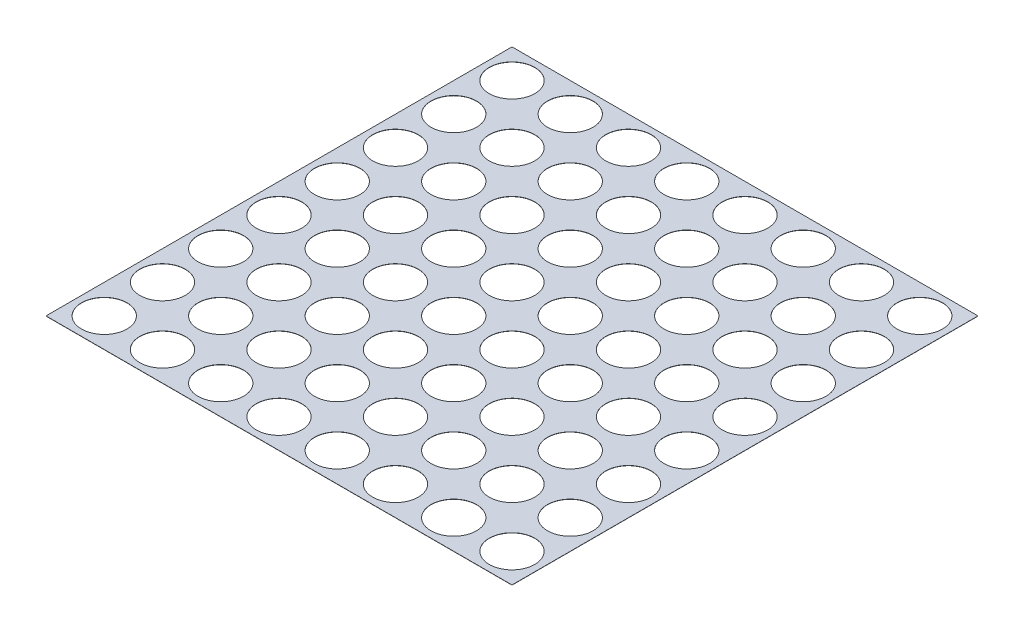
from build123d import *

# Parameters (mm, degrees)
ESBO_O1_W                = 256
ESBO_O1_H                = 256
RESSALTO_EXTRUS_O1_DEPTH = 0.1
ESBO_O2_R                = 12.5
CORTE_EXTRUS_O1_DEPTH    = 182.019363605


with BuildPart() as part:
    # Esboço1 → Ressalto-extrusão1 (new body)
    with BuildSketch(Plane(origin=(0, 0, 0), x_dir=(1, 0, 0), z_dir=(0, 1, 0))):
        Rectangle(ESBO_O1_W, ESBO_O1_H)
    extrude(amount=RESSALTO_EXTRUS_O1_DEPTH)

    # Esboço2 → Corte-extrusão1 (cut, through all)
    with BuildSketch(Plane(origin=(0, 0.1, 0), x_dir=(1, 0, 0), z_dir=(0, 1, 0))):
        with Locations(Location((-112, -112, 0), (0, 0, 270))):
            Circle(ESBO_O2_R)
        with Locations(Location((-80, -112, 0), (0, 0, 90))):
            Circle(ESBO_O2_R)
        with Locations(Location((-48, -112, 0), (0, 0, 270))):
            Circle(ESBO_O2_R)
        with Locations(Location((-16, -112, 0), (0, 0, 90))):
            Circle(ESBO_O2_R)
        with Locations(Location((16, -112, 0), (0, 0, 270))):
            Circle(ESBO_O2_R)
        with Locations(Location((48, -112, 0), (0, 0, 90))):
            Circle(ESBO_O2_R)
        with Locations(Location((80, -112, 0), (0, 0, 270))):
            Circle(ESBO_O2_R)
        with Locations(Location((112, -112, 0), (0, 0, 90))):
            Circle(ESBO_O2_R)
        with Locations(Location((112, -80, 0), (0, 0, 270))):
            Circle(ESBO_O2_R)
        with Locations(Location((80, -80, 0), (0, 0, 90))):
            Circle(ESBO_O2_R)
        with Locations(Location((48, -80, 0), (0, 0, 270))):
            Circle(ESBO_O2_R)
        with Locations(Location((16, -80, 0), (0, 0, 90))):
            Circle(ESBO_O2_R)
        with Locations(Location((-16, -80, 0), (0, 0, 270))):
            Circle(ESBO_O2_R)
        with Locations(Location((-48, -80, 0), (0, 0, 90))):
            Circle(ESBO_O2_R)
        with Locations(Location((-80, -80, 0), (0, 0, 270))):
            Circle(ESBO_O2_R)
        with Locations(Location((-112, -80, 0), (0, 0, 90))):
            Circle(ESBO_O2_R)
        with Locations(Location((112, -16, 0), (0, 0, 270))):
            Circle(ESBO_O2_R)
        with Locations(Location((112, -48, 0), (0, 0, 90))):
            Circle(ESBO_O2_R)
        with Locations(Location((80, -16, 0), (0, 0, 90))):
            Circle(ESBO_O2_R)
        with Locations(Location((80, -48, 0), (0, 0, 270))):
            Circle(ESBO_O2_R)
        with Locations(Location((48, -16, 0), (0, 0, 270))):
            Circle(ESBO_O2_R)
        with Locations(Location((48, -48, 0), (0, 0, 90))):
            Circle(ESBO_O2_R)
        with Locations(Location((16, -16, 0), (0, 0, 90))):
            Circle(ESBO_O2_R)
        with Locations(Location((16, -48, 0), (0, 0, 270))):
            Circle(ESBO_O2_R)
        with Locations(Location((-16, -16, 0), (0, 0, 270))):
            Circle(ESBO_O2_R)
        with Locations(Location((-16, -48, 0), (0, 0, 90))):
            Circle(ESBO_O2_R)
        with Locations(Location((-48, -16, 0), (0, 0, 90))):
            Circle(ESBO_O2_R)
        with Locations(Location((-48, -48, 0), (0, 0, 270))):
            Circle(ESBO_O2_R)
        with Locations(Location((-80, -16, 0), (0, 0, 270))):
            Circle(ESBO_O2_R)
        with Locations(Location((-80, -48, 0), (0, 0, 90))):
            Circle(ESBO_O2_R)
        with Locations(Location((-112, -48, 0), (0, 0, 270))):
            Circle(ESBO_O2_R)
        with Locations(Location((-112, -16, 0), (0, 0, 90))):
            Circle(ESBO_O2_R)
        with Locations(Location((-112, 16, 0), (0, 0, 270))):
            Circle(ESBO_O2_R)
        with Locations(Location((-80, 16, 0), (0, 0, 90))):
            Circle(ESBO_O2_R)
        with Locations(Location((-48, 16, 0), (0, 0, 270))):
            Circle(ESBO_O2_R)
        with Locations(Location((-16, 16, 0), (0, 0, 90))):
            Circle(ESBO_O2_R)
        with Locations(Location((16, 16, 0), (0, 0, 270))):
            Circle(ESBO_O2_R)
        with Locations(Location((48, 16, 0), (0, 0, 90))):
            Circle(ESBO_O2_R)
        with Locations(Location((80, 16, 0), (0, 0, 270))):
            Circle(ESBO_O2_R)
        with Locations(Location((112, 16, 0), (0, 0, 90))):
            Circle(ESBO_O2_R)
        with Locations(Location((112, 48, 0), (0, 0, 270))):
            Circle(ESBO_O2_R)
        with Locations(Location((80, 48, 0), (0, 0, 90))):
            Circle(ESBO_O2_R)
        with Locations(Location((48, 48, 0), (0, 0, 270))):
            Circle(ESBO_O2_R)
        with Locations(Location((16, 48, 0), (0, 0, 90))):
            Circle(ESBO_O2_R)
        with Locations(Location((-16, 48, 0), (0, 0, 270))):
            Circle(ESBO_O2_R)
        with Locations(Location((-48, 48, 0), (0, 0, 90))):
            Circle(ESBO_O2_R)
        with Locations(Location((-80, 48, 0), (0, 0, 270))):
            Circle(ESBO_O2_R)
        with Locations(Location((-112, 48, 0), (0, 0, 90))):
            Circle(ESBO_O2_R)
        with Locations(Location((-112, 80, 0), (0, 0, 270))):
            Circle(ESBO_O2_R)
        with Locations(Location((-80, 80, 0), (0, 0, 90))):
            Circle(ESBO_O2_R)
        with Locations(Location((-48, 80, 0), (0, 0, 270))):
            Circle(ESBO_O2_R)
        with Locations(Location((-16, 80, 0), (0, 0, 90))):
            Circle(ESBO_O2_R)
        with Locations(Location((16, 80, 0), (0, 0, 270))):
            Circle(ESBO_O2_R)
        with Locations(Location((48, 80, 0), (0, 0, 90))):
            Circle(ESBO_O2_R)
        with Locations(Location((80, 80, 0), (0, 0, 270))):
            Circle(ESBO_O2_R)
        with Locations(Location((112, 80, 0), (0, 0, 90))):
            Circle(ESBO_O2_R)
        with Locations(Location((112, 112, 0), (0, 0, 270))):
            Circle(ESBO_O2_R)
        with Locations(Location((80, 112, 0), (0, 0, 90))):
            Circle(ESBO_O2_R)
        with Locations(Location((48, 112, 0), (0, 0, 270))):
            Circle(ESBO_O2_R)
        with Locations(Location((16, 112, 0), (0, 0, 90))):
            Circle(ESBO_O2_R)
        with Locations(Location((-16, 112, 0), (0, 0, 270))):
            Circle(ESBO_O2_R)
        with Locations(Location((-48, 112, 0), (0, 0, 90))):
            Circle(ESBO_O2_R)
        with Locations(Location((-80, 112, 0), (0, 0, 270))):
            Circle(ESBO_O2_R)
        with Locations(Location((-112, 112, 0), (0, 0, 90))):
            Circle(ESBO_O2_R)
    extrude(amount=-CORTE_EXTRUS_O1_DEPTH, mode=Mode.SUBTRACT)


solid = part.part
